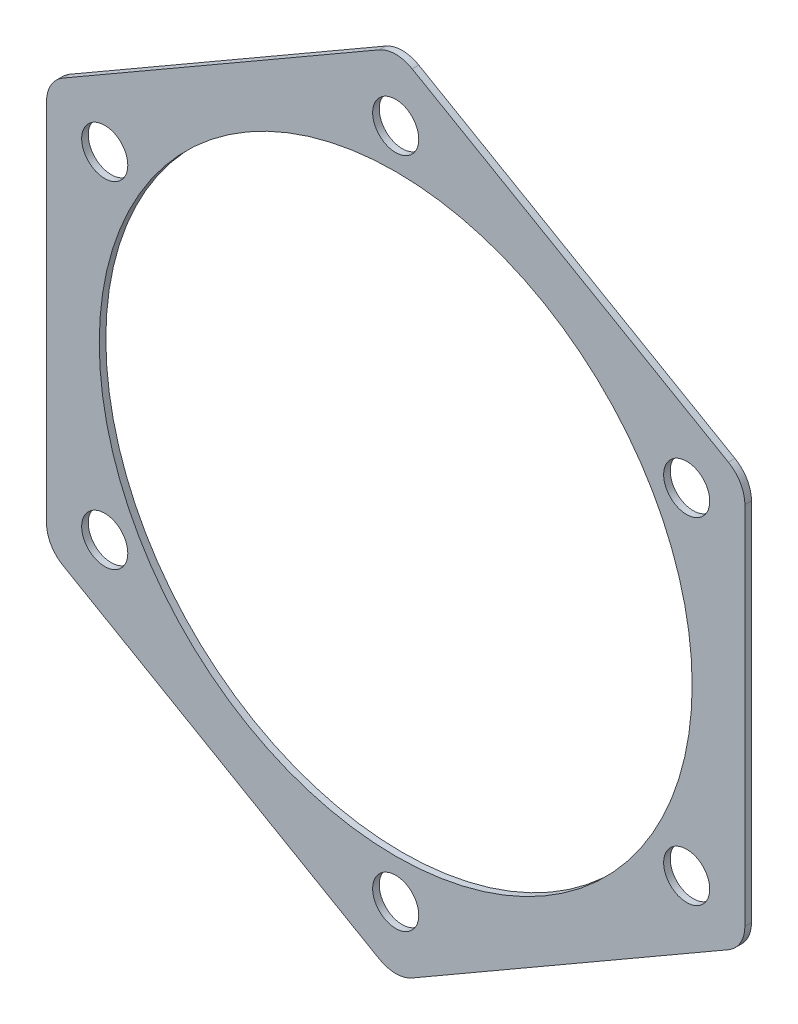
from build123d import *

# Parameters (mm, degrees)
SKETCH1_R           = 45
SKETCH1_R_2         = 3.5
BOSS_EXTRUDE1_DEPTH = 1


with BuildPart() as part:
    # Sketch1 → Boss-Extrude1 (new body)
    with BuildSketch(Plane.XY):
        with BuildLine():
            Line((2.5, -59.755752861), (50.5, -32.04293994))
            ThreePointArc((50.5, -32.04293994), (52.330127019, -30.212812921), (53, -27.712812921))
            Line((53, -27.712812921), (53, 27.712812921))
            ThreePointArc((53, 27.712812921), (52.330127019, 30.212812921), (50.5, 32.04293994))
            Line((50.5, 32.04293994), (2.5, 59.755752861))
            ThreePointArc((2.5, 59.755752861), (0, 60.425625842), (-2.5, 59.755752861))
            Line((-2.5, 59.755752861), (-50.5, 32.04293994))
            ThreePointArc((-50.5, 32.04293994), (-52.330127019, 30.212812921), (-53, 27.712812921))
            Line((-53, 27.712812921), (-53, -27.712812921))
            ThreePointArc((-53, -27.712812921), (-52.330127019, -30.212812921), (-50.5, -32.04293994))
            Line((-50.5, -32.04293994), (-2.5, -59.755752861))
            ThreePointArc((-2.5, -59.755752861), (0, -60.425625842), (2.5, -59.755752861))
        make_face()
        Circle(SKETCH1_R, mode=Mode.SUBTRACT)
        with Locations((0, 51)):
            Circle(SKETCH1_R_2, mode=Mode.SUBTRACT)
        with Locations((44.167295593, 25.5)):
            Circle(SKETCH1_R_2, mode=Mode.SUBTRACT)
        with Locations((44.167295593, -25.5)):
            Circle(SKETCH1_R_2, mode=Mode.SUBTRACT)
        with Locations((0, -51)):
            Circle(SKETCH1_R_2, mode=Mode.SUBTRACT)
        with Locations((-44.167295593, -25.5)):
            Circle(SKETCH1_R_2, mode=Mode.SUBTRACT)
        with Locations((-44.167295593, 25.5)):
            Circle(SKETCH1_R_2, mode=Mode.SUBTRACT)
    extrude(amount=BOSS_EXTRUDE1_DEPTH)


solid = part.part
